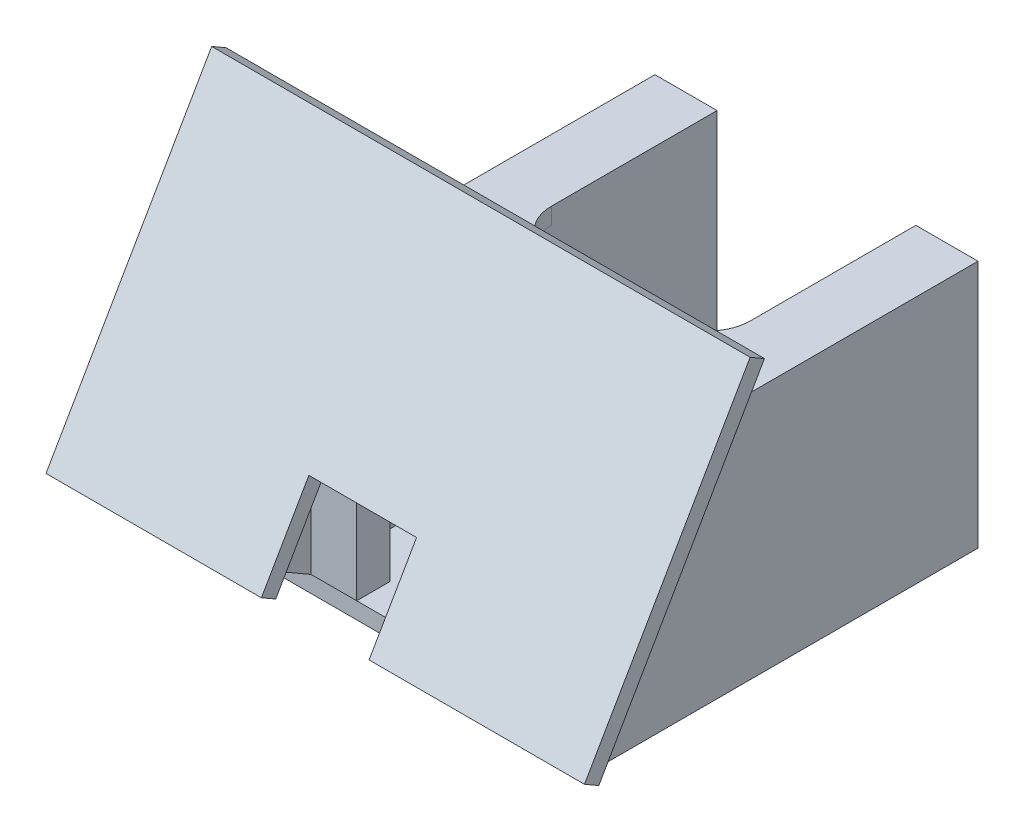
from build123d import *

# Parameters (mm, degrees)
EXTRUDE_1_DEPTH          = 45
EXTRUDE_2_DEPTH          = 4
SKETCH_3_W               = 24
SKETCH_3_H               = 2
CUT_EXTRUDE_1_DEPTH      = 25
SKETCH_5_W               = 40
SKETCH_5_H               = 65
EXTRUDE_3_DEPTH          = 1
CUT_EXTRUDE_2_DEPTH      = 72.51497427
CUT_EXTRUDE_2_DEPTH_BACK = 72.51497427
SKETCH_6_W               = 13
SKETCH_6_H               = 16
EXTRUDE_6_DEPTH          = 2
EXTRUDE_7_DEPTH          = 2
EXTRUDE_8_DEPTH          = 2
EXTRUDE_9_DEPTH          = 2
FILLET_1_R               = 5
EXTRUDE_10_DEPTH         = 5.5
EXTRUDE_11_DEPTH         = 5.5
SKETCH_18_W              = 24
SKETCH_18_H              = 5
EXTRUDE_13_DEPTH         = 3
FILLET_2_R               = 5


with BuildPart() as part:
    # ｽｹｯﾁ1 → ﾎﾞｽ - 押し出し1 (new body)
    with BuildSketch(Plane.XY):
        Polygon((-14, 24), (-14, 2), (-19.5, 2), (-19.5, -6), (19.5, -6), (19.5, 2), (14, 2), (14, 24), align=None)
        Polygon((-12, 0), (-12, 22), (12, 22), (12, 0), (17.5, 0), (17.5, -4), (-17.5, -4), (-17.5, 0), align=None, mode=Mode.SUBTRACT)
    extrude(amount=EXTRUDE_1_DEPTH)

    # ｽｹｯﾁ2 → ﾎﾞｽ - 押し出し2 (add)
    with BuildSketch(Plane.XY.offset(45)):
        Polygon((-14, 24), (-14, 0), (-6.5, 0), (-6.5, 16), (6.5, 16), (6.5, 0), (14, 0), (14, 24), align=None)
    extrude(amount=EXTRUDE_2_DEPTH)

    # ｽｹｯﾁ3 → ｶｯﾄ - 押し出し1 (cut)
    with BuildSketch(Plane(origin=(0, 0, 0), x_dir=(-1, 0, 0), z_dir=(0, 0, -1))):
        with Locations((0, 23)):
            Rectangle(SKETCH_3_W, SKETCH_3_H)
    extrude(amount=-CUT_EXTRUDE_1_DEPTH, mode=Mode.SUBTRACT)



with BuildPart() as body_2:
    # ｽｹｯﾁ5 → ﾎﾞｽ - 押し出し3 (new, symmetric)
    with BuildSketch(Plane(origin=(0, 27.217622393, 47.142304845), x_dir=(0, -0.8660254037844413, 0.4999999999999954), z_dir=(0, 0.4999999999999954, 0.8660254037844413))):
        with Locations((5, 0)):
            Rectangle(SKETCH_5_W, SKETCH_5_H)
    extrude(amount=EXTRUDE_3_DEPTH, both=True)

    # ｽｹｯﾁ6 → ｶｯﾄ - 押し出し2 (cut, two sides: drawn at the far end of the back side and taken through both)
    with BuildSketch(Plane.XY.offset(49).offset(-CUT_EXTRUDE_2_DEPTH_BACK)):
        with Locations((0, 8)):
            Rectangle(SKETCH_6_W, SKETCH_6_H)
    extrude(amount=CUT_EXTRUDE_2_DEPTH + CUT_EXTRUDE_2_DEPTH_BACK, mode=Mode.SUBTRACT)


with BuildPart() as part_1:
    add(part.part)

    add(body_2.part)  # ﾎﾞｽ - 押し出し6 merges body 2
    # ｽｹｯﾁ11 → ﾎﾞｽ - 押し出し6 (add)
    with BuildSketch(Plane.ZY.offset(14)):
        Polygon((40.345299462, 36.990381057), (32.845299462, 24), (47.845299462, 24), align=None)
    extrude(amount=-EXTRUDE_6_DEPTH)

    # ｽｹｯﾁ12 → ﾎﾞｽ - 押し出し7 (add)
    with BuildSketch(Plane(origin=(14, 0, 0), x_dir=(0, 0, -1), z_dir=(1, 0, 0))):
        Polygon((-47.845299462, 24), (-32.845299462, 24), (-40.345299462, 36.990381057), align=None)
    extrude(amount=-EXTRUDE_7_DEPTH)

    # ｽｹｯﾁ13 → ﾎﾞｽ - 押し出し8 (add)
    with BuildSketch(Plane.ZY.offset(14)):
        Polygon((49, 22), (49, 0), (58.526279442, 5.5), align=None)
    extrude(amount=-EXTRUDE_8_DEPTH)

    # ｽｹｯﾁ14 → ﾎﾞｽ - 押し出し9 (add)
    with BuildSketch(Plane(origin=(14, 0, 0), x_dir=(0, 0, -1), z_dir=(1, 0, 0))):
        Polygon((-49, 22), (-49, 0), (-58.526279442, 5.5), align=None)
    extrude(amount=-EXTRUDE_9_DEPTH)

    # ﾌｨﾚｯﾄ1
    fillet_1_edges = [part_1.edges().sort_by_distance(p)[0] for p in [
        (12, 23, 25),
        (-12, 23, 25),
    ]]
    fillet(fillet_1_edges, radius=FILLET_1_R)

    # ｽｹｯﾁ16 → ﾎﾞｽ - 押し出し10 (add)
    with BuildSketch(Plane.ZY.offset(14)):
        Polygon((0, 24), (0, 2), (45, 2), (45, 0), (49, 0), (58.526279442, 5.5), (40.345299462, 36.990381057), (32.845299462, 24), align=None)
    extrude(amount=EXTRUDE_10_DEPTH)

    # ｽｹｯﾁ17 → ﾎﾞｽ - 押し出し11 (add)
    with BuildSketch(Plane(origin=(14, 0, 0), x_dir=(0, 0, -1), z_dir=(1, 0, 0))):
        Polygon((0, 24), (0, 2), (-45, 2), (-45, 0), (-49, 0), (-58.526279442, 5.5), (-40.345299462, 36.990381057), (-32.845299462, 24), align=None)
    extrude(amount=EXTRUDE_11_DEPTH)

    # ｽｹｯﾁ18 → ﾎﾞｽ - 押し出し13 (add)
    with BuildSketch(Plane(origin=(0, 26.717622393, 46.276279442), x_dir=(-1, 0, 0), z_dir=(0, -0.4999999999999954, -0.8660254037844414))):
        with Locations((0, -7.947441117)):
            Rectangle(SKETCH_18_W, SKETCH_18_H)
    extrude(amount=EXTRUDE_13_DEPTH)

    # ﾌｨﾚｯﾄ2
    fillet_2_edges = [part_1.edges().sort_by_distance(p)[0] for p in [
        (-19.5, 21.245190528, 49.435789452),
        (19.5, 21.245190528, 49.435789452),
    ]]
    fillet(fillet_2_edges, radius=FILLET_2_R)


solid = part_1.part
